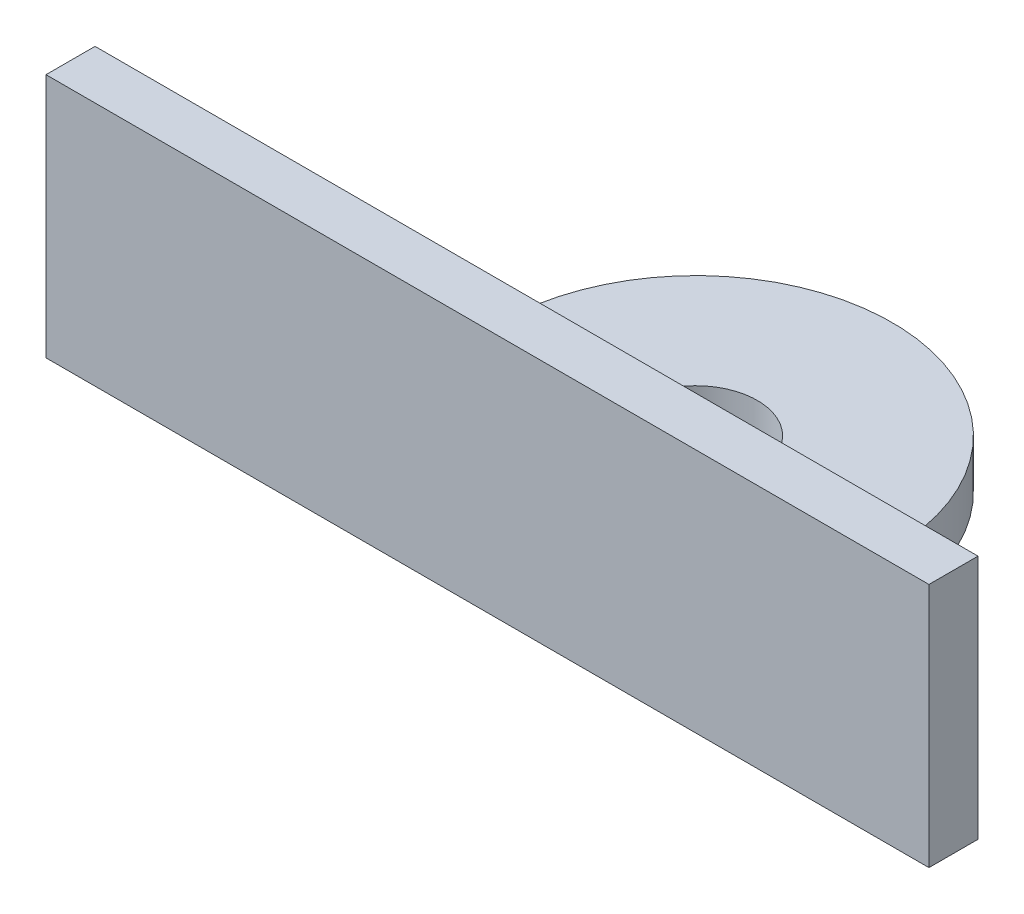
from build123d import *

# Parameters (mm, degrees)
SKETCH1_R           = 12.5
BOSS_EXTRUDE1_DEPTH = 10
SKETCH2_W           = 180
SKETCH2_H           = 50
BOSS_EXTRUDE2_DEPTH = 10


with BuildPart() as part:
    # Sketch1 → Boss-Extrude1 (new body)
    with BuildSketch(Plane(origin=(0, 0, 0), x_dir=(1, 0, 0), z_dir=(0, 1, 0))):
        with BuildLine():
            Line((-40, 0), (40, 0))
            Line((40, 0), (40, 42.5))
            ThreePointArc((40, 42.5), (0, 82.5), (-40, 42.5))
            Line((-40, 42.5), (-40, 0))
        make_face()
        with Locations(Location((0, 42.5, 0), (0, 0, 270))):
            Circle(SKETCH1_R, mode=Mode.SUBTRACT)
    extrude(amount=BOSS_EXTRUDE1_DEPTH)

    # Sketch2 → Boss-Extrude2 (add)
    with BuildSketch(Plane.XY):
        with Locations((0, 25)):
            Rectangle(SKETCH2_W, SKETCH2_H)
    extrude(amount=-BOSS_EXTRUDE2_DEPTH)


solid = part.part
